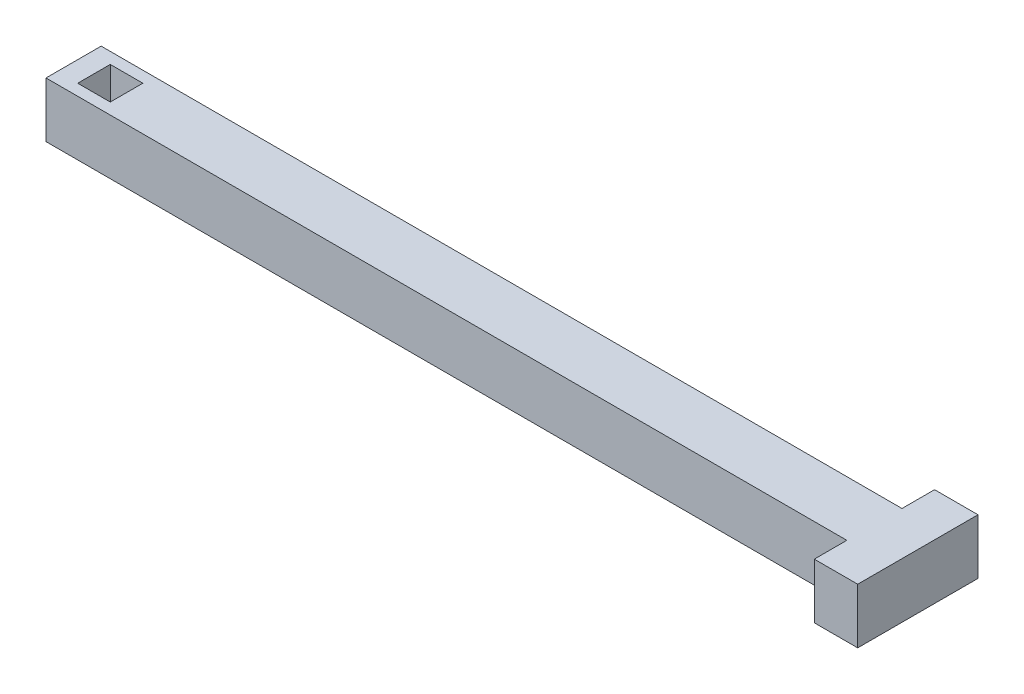
from build123d import *

# Parameters (mm, degrees)
SKETCH1_W           = 1.5
SKETCH1_H           = 1.5
BOSS_EXTRUDE1_DEPTH = 2.54


with BuildPart() as part:
    # Sketch1 → Boss-Extrude1 (new body)
    with BuildSketch(Plane(origin=(0, 0, 0), x_dir=(1, 0, 0), z_dir=(0, 1, 0))):
        Polygon((18.44, 1.27), (18.44, 2.77), (20.44, 2.77), (20.44, -2.77), (18.44, -2.77), (18.44, -1.27), (-18.44, -1.27), (-18.44, 1.27), align=None)
        with Locations((-16.75, 0)):
            Rectangle(SKETCH1_W, SKETCH1_H, mode=Mode.SUBTRACT)
    extrude(amount=BOSS_EXTRUDE1_DEPTH)


solid = part.part
